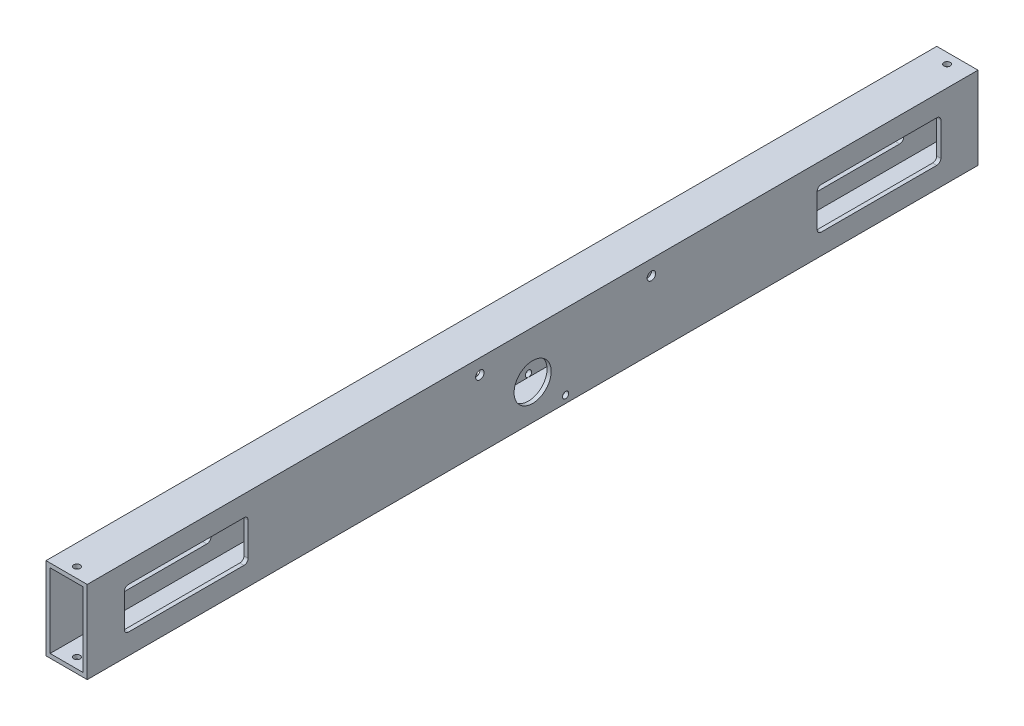
from build123d import *

# Parameters (mm, degrees)
SKETCH1_W                    = 31.75
SKETCH1_H                    = 63.5
SKETCH1_W_2                  = 25.4
SKETCH1_H_2                  = 57.15
BOSS_EXTRUDE1_DEPTH          = 685.8
CUT_EXTRUDE1_REACH           = 691.238
F_10_0_1935_DIAMETER_HOLE1_D = 4.9149
CUT_EXTRUDE2_START           = -31.75
SKETCH6_R                    = 14.2875
SKETCH6_R_2                  = 3.2639
SKETCH6_R_3                  = 2.413
CUT_EXTRUDE2_DEPTH           = 31.75


with BuildPart() as part:
    # Sketch1 → Boss-Extrude1 (new body)
    with BuildSketch(Plane.XY):
        with Locations((3.710272719, -29.23968021)):
            Rectangle(SKETCH1_W, SKETCH1_H)
        with Locations((3.710272719, -29.23968021)):
            Rectangle(SKETCH1_W_2, SKETCH1_H_2, mode=Mode.SUBTRACT)
    extrude(amount=BOSS_EXTRUDE1_DEPTH)

    # Cut-Extrude1: up to this face of the body (flat: up to its plane)
    cut_extrude1_end = Plane(part.part.faces().sort_by_distance((19.585272719, -29.23968021, 342.9))[0])
    # Sketch3 → Cut-Extrude1 (cut, up to the picked face)
    with BuildSketch(Plane.ZY.offset(12.164727281), mode=Mode.PRIVATE) as cut_extrude1_sk1:
        with BuildLine():
            Line((31.7754, -13.36468021), (120.6754, -13.36468021))
            ThreePointArc((120.6754, -13.36468021), (122.92046403, -14.294616179), (123.8504, -16.53968021))
            Line((123.8504, -16.53968021), (123.8504, -41.93968021))
            ThreePointArc((123.8504, -41.93968021), (122.92046403, -44.18474424), (120.6754, -45.11468021))
            Line((120.6754, -45.11468021), (31.7754, -45.11468021))
            ThreePointArc((31.7754, -45.11468021), (29.53033597, -44.18474424), (28.6004, -41.93968021))
            Line((28.6004, -41.93968021), (28.6004, -16.53968021))
            ThreePointArc((28.6004, -16.53968021), (29.53033597, -14.294616179), (31.7754, -13.36468021))
        make_face()
    cut_extrude1_tool1 = split(extrude(cut_extrude1_sk1.sketch, amount=-CUT_EXTRUDE1_REACH, mode=Mode.PRIVATE), bisect_by=cut_extrude1_end, keep=Keep.BOTH, mode=Mode.PRIVATE)
    # Sketch3 → Cut-Extrude1 (cut, up to the picked face)
    with BuildSketch(Plane.ZY.offset(12.164727281), mode=Mode.PRIVATE) as cut_extrude1_sk2:
        with BuildLine():
            ThreePointArc((657.1996, -41.93968021), (656.26966403, -44.18474424), (654.0246, -45.11468021))
            Line((654.0246, -45.11468021), (565.1246, -45.11468021))
            ThreePointArc((565.1246, -45.11468021), (562.87953597, -44.18474424), (561.9496, -41.93968021))
            Line((561.9496, -41.93968021), (561.9496, -16.53968021))
            ThreePointArc((561.9496, -16.53968021), (562.87953597, -14.294616179), (565.1246, -13.36468021))
            Line((565.1246, -13.36468021), (654.0246, -13.36468021))
            ThreePointArc((654.0246, -13.36468021), (656.26966403, -14.294616179), (657.1996, -16.53968021))
            Line((657.1996, -16.53968021), (657.1996, -41.93968021))
        make_face()
    cut_extrude1_tool2 = split(extrude(cut_extrude1_sk2.sketch, amount=-CUT_EXTRUDE1_REACH, mode=Mode.PRIVATE), bisect_by=cut_extrude1_end, keep=Keep.BOTH, mode=Mode.PRIVATE)
    add(cut_extrude1_tool1.solids().sort_by(Axis((-12.164727, -29.23968, 76.2254), (1, 0, 0)))[0], mode=Mode.SUBTRACT)
    add(cut_extrude1_tool2.solids().sort_by(Axis((-12.164727, -29.23968, 609.5746), (1, 0, 0)))[0], mode=Mode.SUBTRACT)

    # #10 (0.1935) Diameter Hole1 (through all)
    with Locations(Plane(origin=(3.710272719, 2.51031979, 677.8625), x_dir=(1, 0, 0), z_dir=(0, 1, 0))):
        with Locations((0, 0), (0, 669.925)):
            Hole(F_10_0_1935_DIAMETER_HOLE1_D / 2)

    # Sketch6 → Cut-Extrude2 (cut)
    with BuildSketch(Plane(origin=(19.585272719, 0, 0), x_dir=(0, 0, -1), z_dir=(1, 0, 0)).offset(CUT_EXTRUDE2_START)):
        with Locations(Location((-342.9, -34.00218021, 0), (0, 0, 90))):
            Circle(SKETCH6_R)
        with Locations(Location((-383.54, -8.91968021, 0), (0, 0, 90))):
            Circle(SKETCH6_R_2)
        with Locations(Location((-251.46, -8.91968021, 0), (0, 0, 90))):
            Circle(SKETCH6_R_2)
        with Locations(Location((-317.5, -55.40168021, 0), (0, 0, 90))):
            Circle(SKETCH6_R_3)
    extrude(amount=CUT_EXTRUDE2_DEPTH, mode=Mode.SUBTRACT)


solid = part.part
